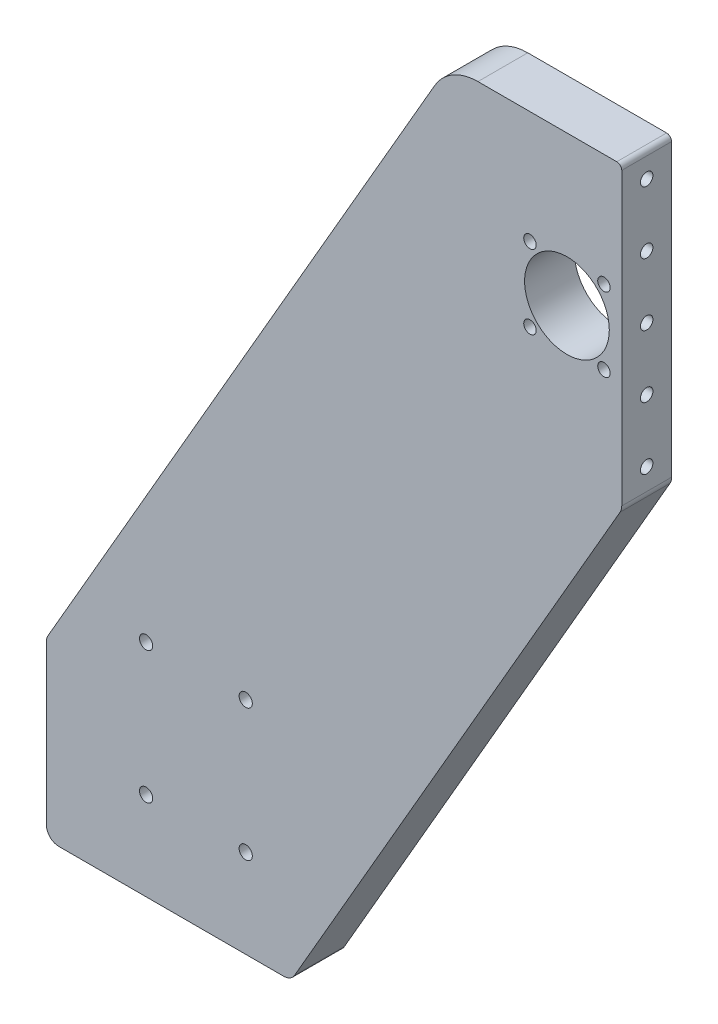
from build123d import *

# Parameters (mm, degrees)
SCHIZZO1_R                    = 17
SCHIZZO1_R_2                  = 2.5
ESTRUSIONE_ESTRUSIONE2_DEPTH  = 20
M5_TAPPED_HOLE1_D             = 4.2
M5_TAPPED_HOLE1_DEPTH         = 17.4
M5_TAPPED_HOLE1_TIP           = 1.2618073
CBORE_FOR_M5_SHCS1_AT_2_COUNT = 2
CBORE_FOR_M5_SHCS1_AT_2_PITCH = 53
CBORE_FOR_M5_SHCS1_AT_3_COUNT = 2
CBORE_FOR_M5_SHCS1_AT_3_PITCH = 66.400301204
CBORE_FOR_M5_SHCS1_AT_4_COUNT = 2
CBORE_FOR_M5_SHCS1_AT_4_PITCH = 40
M6_TAPPED_HOLE1_D             = 5
M6_TAPPED_HOLE1_DEPTH         = 19
M6_TAPPED_HOLE1_TIP           = 1.502151548


with BuildPart() as part:
    # Schizzo1 → Estrusione-Estrusione2 (new body)
    with BuildSketch(Plane.XY):
        with BuildLine():
            Line((5, 0), (95.262794416, 0))
            ThreePointArc((95.262794416, 0), (97.762794416, 0.669872981), (99.592921435, 2.5))
            Line((99.592921435, 2.5), (230.270234695, 228.839745962))
            ThreePointArc((230.270234695, 228.839745962), (230.769736807, 230.045650737), (230.940107676, 231.339745962))
            Line((230.940107676, 231.339745962), (230.940107676, 348))
            ThreePointArc((230.940107676, 348), (230.354321238, 349.414213562), (228.940107676, 350))
            Line((228.940107676, 350), (173.205080757, 350))
            ThreePointArc((173.205080757, 350), (163.205080757, 347.320508076), (155.884572681, 340))
            Line((155.884572681, 340), (0.669872981, 71.160254038))
            ThreePointArc((0.669872981, 71.160254038), (0.170370869, 69.954349263), (0, 68.660254038))
            Line((0, 68.660254038), (0, 5))
            ThreePointArc((0, 5), (1.464466094, 1.464466094), (5, 0))
        make_face()
        with Locations((208.940107676, 290)):
            Circle(SCHIZZO1_R, mode=Mode.SUBTRACT)
        with Locations((223.789350081, 304.849242405)):
            Circle(SCHIZZO1_R_2, mode=Mode.SUBTRACT)
        with Locations((223.789350081, 275.150757595)):
            Circle(SCHIZZO1_R_2, mode=Mode.SUBTRACT)
        with Locations((194.090865271, 275.150757595)):
            Circle(SCHIZZO1_R_2, mode=Mode.SUBTRACT)
        with Locations((194.090865271, 304.849242405)):
            Circle(SCHIZZO1_R_2, mode=Mode.SUBTRACT)
    extrude(amount=-ESTRUSIONE_ESTRUSIONE2_DEPTH)

    # M5 Tapped Hole1
    with Locations(Plane(origin=(50.131397208, 0, -10), x_dir=(0, 0, -1), z_dir=(0, -1, 0))):
        with Locations((0, 0), (0, 35), (0, -35)):
            Hole(M5_TAPPED_HOLE1_D / 2, depth=M5_TAPPED_HOLE1_DEPTH)
            with Locations((0, 0, -(M5_TAPPED_HOLE1_DEPTH + M5_TAPPED_HOLE1_TIP / 2))):  # 118° drill point
                Cone(0, M5_TAPPED_HOLE1_D / 2, M5_TAPPED_HOLE1_TIP, mode=Mode.SUBTRACT)

    # Sketch5 → CBORE for M5 SHCS1 (revolve, cut)
    with BuildSketch(Plane(origin=(80, 88.5, -20), x_dir=(0, 1, 0), z_dir=(1, 0, 0))):
        Polygon((0, 0), (0, 20), (2.65, 20), (2.65, 5), (5, 5), (5, 1.145), (6.145, 0), align=None)
    cbore_for_m5_shcs1 = revolve(axis=Axis((80, 88.5, -26.35), (0, 0, 1)), mode=Mode.SUBTRACT)

    # CBORE for M5 SHCS1 at 2: CBORE for M5 SHCS1 ×2
    with Locations(*[(0, -i * CBORE_FOR_M5_SHCS1_AT_2_PITCH, 0) for i in range(1, CBORE_FOR_M5_SHCS1_AT_2_COUNT)]):
        add(cbore_for_m5_shcs1, mode=Mode.SUBTRACT)

    # CBORE for M5 SHCS1 at 3: CBORE for M5 SHCS1 ×2
    with Locations(*[Vector(-0.6024069059118721, -0.7981891503332309, 0) * (i * CBORE_FOR_M5_SHCS1_AT_3_PITCH) for i in range(1, CBORE_FOR_M5_SHCS1_AT_3_COUNT)]):
        add(cbore_for_m5_shcs1, mode=Mode.SUBTRACT)

    # CBORE for M5 SHCS1 at 4: CBORE for M5 SHCS1 ×2
    with Locations(*[(-i * CBORE_FOR_M5_SHCS1_AT_4_PITCH, 0, 0) for i in range(1, CBORE_FOR_M5_SHCS1_AT_4_COUNT)]):
        add(cbore_for_m5_shcs1, mode=Mode.SUBTRACT)

    # M6 Tapped Hole1
    with Locations(Plane(origin=(230.940107676, 340, -10), x_dir=(0, 0, 1), z_dir=(1, 0, 0))):
        with Locations((0, 0), (0, 25), (0, 50), (0, 75), (0, 100)):
            Hole(M6_TAPPED_HOLE1_D / 2, depth=M6_TAPPED_HOLE1_DEPTH)
            with Locations((0, 0, -(M6_TAPPED_HOLE1_DEPTH + M6_TAPPED_HOLE1_TIP / 2))):  # 118° drill point
                Cone(0, M6_TAPPED_HOLE1_D / 2, M6_TAPPED_HOLE1_TIP, mode=Mode.SUBTRACT)


solid = part.part
